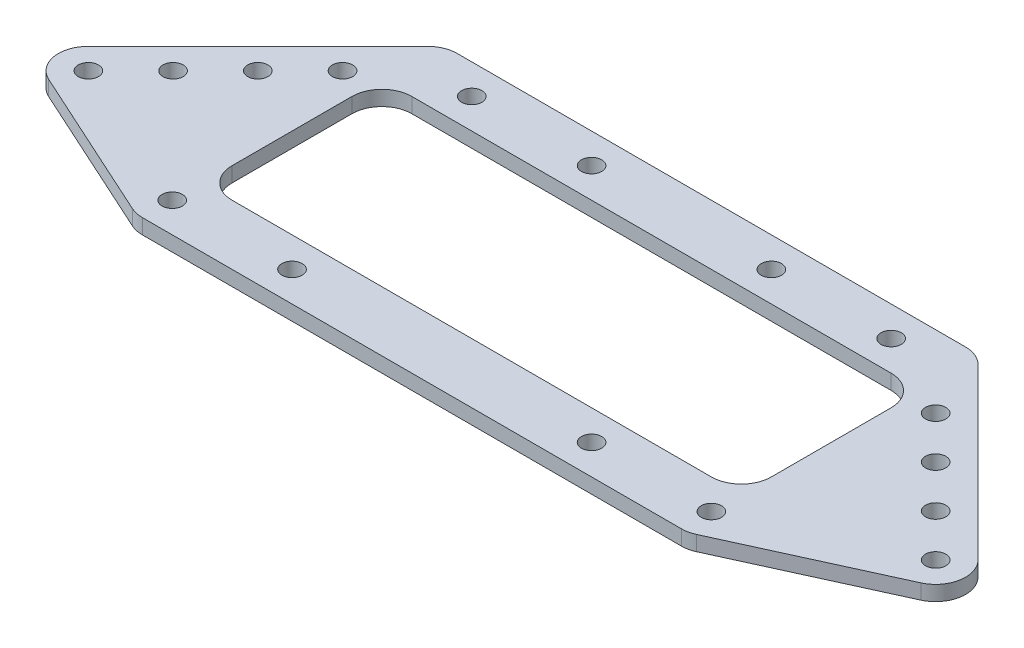
from build123d import *

# Parameters (mm, degrees)
SKETCH1_R           = 2.15
BOSS_EXTRUDE1_DEPTH = 3.175


with BuildPart() as part:
    # Sketch1 → Boss-Extrude1 (new body)
    with BuildSketch(Plane(origin=(0, 0, 0), x_dir=(1, 0, 0), z_dir=(0, 1, 0))):
        with BuildLine():
            Line((98.331536726, 6.35), (-9.431536726, 6.35))
            ThreePointArc((-9.431536726, 6.35), (-11.861576522, 5.866635031), (-13.921664787, 4.490128061))
            Line((-13.921664787, 4.490128061), (-49.842689271, -31.430896424))
            ThreePointArc((-49.842689271, -31.430896424), (-51.601195943, -37.051097041), (-47.985620944, -41.699388997))
            Line((-47.985620944, -41.699388997), (-15.333059733, -56.578364513))
            ThreePointArc((-15.333059733, -56.578364513), (-14.047198082, -57.00544578), (-12.7, -57.15))
            Line((-12.7, -57.15), (101.6, -57.15))
            ThreePointArc((101.6, -57.15), (102.947198082, -57.00544578), (104.233059733, -56.578364513))
            Line((104.233059733, -56.578364513), (136.885620944, -41.699388997))
            ThreePointArc((136.885620944, -41.699388997), (140.501195943, -37.051097041), (138.742689271, -31.430896424))
            Line((138.742689271, -31.430896424), (102.821664787, 4.490128061))
            ThreePointArc((102.821664787, 4.490128061), (100.761576522, 5.866635031), (98.331536726, 6.35))
        make_face()
        with Locations(Location((0, 0, 0), (0, 0, 270))):
            Circle(SKETCH1_R, mode=Mode.SUBTRACT)
        with Locations(Location((25.4, 0, 0), (0, 0, 270))):
            Circle(SKETCH1_R, mode=Mode.SUBTRACT)
        with Locations(Location((-18.411792847, -8.980256121, 0), (0, 0, 270))):
            Circle(SKETCH1_R, mode=Mode.SUBTRACT)
        with Locations(Location((-27.392048969, -17.960512242, 0), (0, 0, 270))):
            Circle(SKETCH1_R, mode=Mode.SUBTRACT)
        with Locations(Location((-36.37230509, -26.940768363, 0), (0, 0, 270))):
            Circle(SKETCH1_R, mode=Mode.SUBTRACT)
        with Locations(Location((-45.352561211, -35.921024484, 0), (0, 0, 270))):
            Circle(SKETCH1_R, mode=Mode.SUBTRACT)
        with Locations(Location((-12.7, -50.8, 0), (0, 0, 270))):
            Circle(SKETCH1_R, mode=Mode.SUBTRACT)
        with Locations(Location((12.7, -50.8, 0), (0, 0, 270))):
            Circle(SKETCH1_R, mode=Mode.SUBTRACT)
        with Locations(Location((63.5, 0, 0), (0, 0, 90))):
            Circle(SKETCH1_R, mode=Mode.SUBTRACT)
        with Locations(Location((88.9, 0, 0), (0, 0, 90))):
            Circle(SKETCH1_R, mode=Mode.SUBTRACT)
        with Locations(Location((107.311792847, -8.980256121, 0), (0, 0, 90))):
            Circle(SKETCH1_R, mode=Mode.SUBTRACT)
        with Locations(Location((116.292048969, -17.960512242, 0), (0, 0, 90))):
            Circle(SKETCH1_R, mode=Mode.SUBTRACT)
        with Locations(Location((134.252561211, -35.921024484, 0), (0, 0, 90))):
            Circle(SKETCH1_R, mode=Mode.SUBTRACT)
        with Locations(Location((125.27230509, -26.940768363, 0), (0, 0, 90))):
            Circle(SKETCH1_R, mode=Mode.SUBTRACT)
        with Locations(Location((76.2, -50.8, 0), (0, 0, 90))):
            Circle(SKETCH1_R, mode=Mode.SUBTRACT)
        with Locations(Location((101.6, -50.8, 0), (0, 0, 90))):
            Circle(SKETCH1_R, mode=Mode.SUBTRACT)
        with BuildLine():
            Line((95.25, -6.35), (-6.35, -6.35))
            ThreePointArc((-6.35, -6.35), (-10.840128061, -8.209871939), (-12.7, -12.7))
            Line((-12.7, -12.7), (-12.7, -38.1))
            ThreePointArc((-12.7, -38.1), (-10.840128061, -42.590128061), (-6.35, -44.45))
            Line((-6.35, -44.45), (95.25, -44.45))
            ThreePointArc((95.25, -44.45), (99.740128061, -42.590128061), (101.6, -38.1))
            Line((101.6, -38.1), (101.6, -12.7))
            ThreePointArc((101.6, -12.7), (99.740128061, -8.209871939), (95.25, -6.35))
        make_face(mode=Mode.SUBTRACT)
    extrude(amount=BOSS_EXTRUDE1_DEPTH)


solid = part.part
